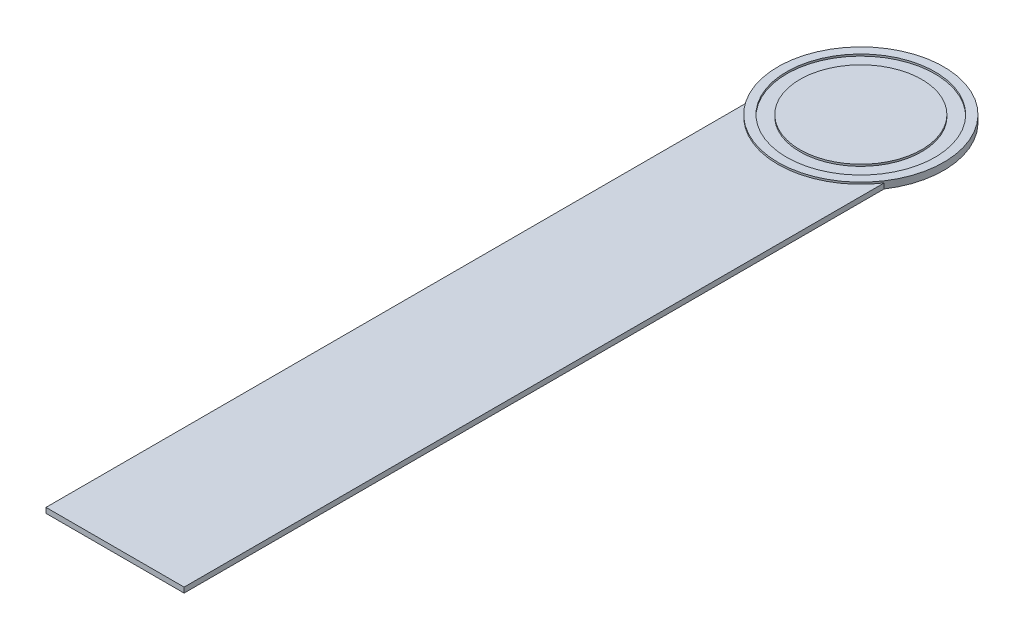
from build123d import *

# Parameters (mm, degrees)
SKETCH1_R             = 3.81
SKETCH1_R_2           = 3.41
BOSS_EXTRUDE1_DEPTH   = 0.325
SKETCH1_R_3           = 2.8
BOSS_EXTRUDE1_2_DEPTH = 0.325
SKETCH1_3_R           = 3.41
SKETCH1_3_R_2         = 2.8
BOSS_EXTRUDE2_DEPTH   = 0.24


with BuildPart() as part:
    # Sketch1 → Boss-Extrude1 (new body)
    with BuildSketch(Plane(origin=(0, 0, 0), x_dir=(1, 0, 0), z_dir=(0, 1, 0))):
        Circle(SKETCH1_R)
        Circle(SKETCH1_R_2, mode=Mode.SUBTRACT)
    extrude(amount=BOSS_EXTRUDE1_DEPTH)



with BuildPart() as body_2:
    # Sketch1 → Boss-Extrude1 2 (new body)
    with BuildSketch(Plane(origin=(0, 0, 0), x_dir=(1, 0, 0), z_dir=(0, 1, 0))):
        Circle(SKETCH1_R_3)
    extrude(amount=BOSS_EXTRUDE1_2_DEPTH)


with BuildPart() as part_1:
    add(part.part)

    add(body_2.part)  # Boss-Extrude2 merges body 2
    # Sketch1<3> → Boss-Extrude2 (add)
    # profile 1 of 2: a face of its own
    with BuildSketch(Plane(origin=(0, 0, 0), x_dir=(1, 0, 0), z_dir=(0, 1, 0))):
        with BuildLine():
            Line((-3.175, -2.106056742), (-3.175, -34.29))
            Line((-3.175, -34.29), (3.175, -34.29))
            Line((3.175, -34.29), (3.175, -2.106056742))
            ThreePointArc((3.175, -2.106056742), (0, -3.81), (-3.175, -2.106056742))
        make_face()
    # profile 2 of 2: a face of its own
    with BuildSketch(Plane(origin=(0, 0, 0), x_dir=(1, 0, 0), z_dir=(0, 1, 0))):
        Circle(SKETCH1_3_R)
        Circle(SKETCH1_3_R_2, mode=Mode.SUBTRACT)
    extrude(amount=BOSS_EXTRUDE2_DEPTH)


solid = part_1.part
